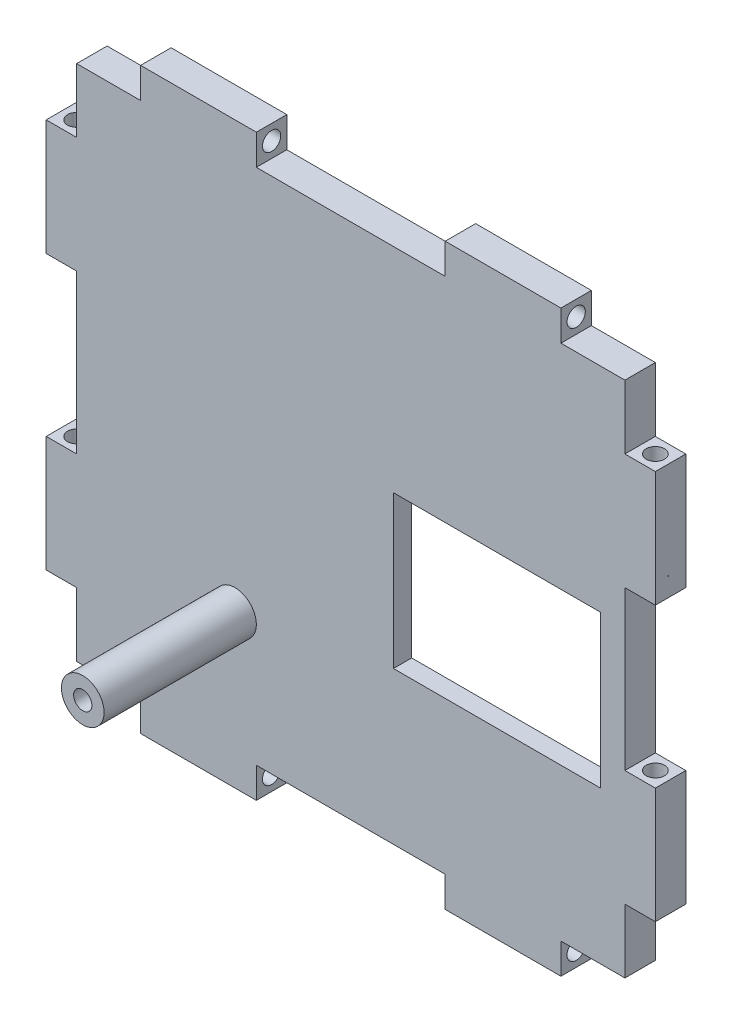
from build123d import *

# Parameters (mm, degrees)
BOSS_EXTRU_1_DEPTH      = 5
ENL_V_MAT_EXTRU_1_REACH = 129.849
ESQUISSE2_R             = 1.5
ENL_V_MAT_EXTRU_2_REACH = 136.797
ESQUISSE3_R             = 1.5
ENL_V_MAT_EXTRU_3_REACH = 129.849
ESQUISSE4_R             = 1.5
ENL_V_MAT_EXTRU_4_REACH = 129.615
ESQUISSE5_R             = 1.5
ESQUISSE6_R             = 3.5
ESQUISSE6_R_2           = 1.5
BOSS_EXTRU_2_DEPTH      = 30
ENL_V_MAT_EXTRU_5_REACH = 142.518
ESQUISSE7_R             = 1.5
ESQUISSE8_W             = 34
ESQUISSE8_H             = 25
ENL_V_MAT_EXTRU_6_DEPTH = 5
ESQUISSE9_W             = 51
ESQUISSE9_H             = 51
ENL_V_MAT_EXTRU_7_DEPTH = 2


with BuildPart() as part:
    # Esquisse1 → Boss.-Extru.1 (new body)
    with BuildSketch(Plane.XY):
        Polygon((15.5, 95.5), (15.5, 90.5), (5, 90.5), (5, 80), (0, 80), (0, 61), (5, 61), (5, 35), (0, 35), (0, 16), (5, 16), (5, 5.5), (15.5, 5.5), (15.5, 0.5), (34.5, 0.5), (34.5, 5.5), (65.5, 5.5), (65.5, 0.5), (84.5, 0.5), (84.5, 5.5), (95, 5.5), (95, 16), (100, 16), (100, 35), (95, 35), (95, 61), (100, 61), (100, 80), (95, 80), (95, 90.5), (84.5, 90.5), (84.5, 95.5), (65.5, 95.5), (65.5, 90.5), (34.5, 90.5), (34.5, 95.5), align=None)
    extrude(amount=BOSS_EXTRU_1_DEPTH)

    # Enlèv. mat.-Extru.1: up to this face of the body (flat: up to its plane)
    enl_v_mat_extru_1_end = Plane(part.part.faces().sort_by_distance((97.5, 80, 2.5))[0])
    # Esquisse2 → Enlèv. mat.-Extru.1 (cut, up to the picked face)
    with BuildSketch(Plane.XZ.offset(-16), mode=Mode.PRIVATE) as enl_v_mat_extru_1_sk1:
        with Locations((97.5, 2.5)):
            Circle(ESQUISSE2_R)
    enl_v_mat_extru_1_tool1 = split(extrude(enl_v_mat_extru_1_sk1.sketch, amount=-ENL_V_MAT_EXTRU_1_REACH, mode=Mode.PRIVATE), bisect_by=enl_v_mat_extru_1_end, keep=Keep.BOTH, mode=Mode.PRIVATE)
    add(enl_v_mat_extru_1_tool1.solids().sort_by(Axis((97.5, 16, 2.5), (0, 1, 0)))[0], mode=Mode.SUBTRACT)

    # Enlèv. mat.-Extru.2: up to this face of the body (flat: up to its plane)
    enl_v_mat_extru_2_end = Plane(part.part.faces().sort_by_distance((5, 85.25, 2.5))[0])
    # Esquisse3 → Enlèv. mat.-Extru.2 (cut, up to the picked face)
    with BuildSketch(Plane(origin=(95, 0, 0), x_dir=(0, 0, -1), z_dir=(1, 0, 0)), mode=Mode.PRIVATE) as enl_v_mat_extru_2_sk1:
        with Locations(Location((-2.5, 93, 0), (0, 0, 90))):
            Circle(ESQUISSE3_R)
    enl_v_mat_extru_2_tool1 = split(extrude(enl_v_mat_extru_2_sk1.sketch, amount=-ENL_V_MAT_EXTRU_2_REACH, mode=Mode.PRIVATE), bisect_by=enl_v_mat_extru_2_end, keep=Keep.BOTH, mode=Mode.PRIVATE)
    add(enl_v_mat_extru_2_tool1.solids().sort_by(Axis((95, 93, 2.5), (-1, 0, 0)))[0], mode=Mode.SUBTRACT)

    # Enlèv. mat.-Extru.3: up to this face of the body (flat: up to its plane)
    enl_v_mat_extru_3_end = Plane(part.part.faces().sort_by_distance((2.5, 16, 2.5))[0])
    # Esquisse4 → Enlèv. mat.-Extru.3 (cut, up to the picked face)
    with BuildSketch(Plane(origin=(0, 80, 0), x_dir=(1, 0, 0), z_dir=(0, 1, 0)), mode=Mode.PRIVATE) as enl_v_mat_extru_3_sk1:
        with Locations(Location((2.5, -2.5, 0), (0, 0, 270))):
            Circle(ESQUISSE4_R)
    enl_v_mat_extru_3_tool1 = split(extrude(enl_v_mat_extru_3_sk1.sketch, amount=-ENL_V_MAT_EXTRU_3_REACH, mode=Mode.PRIVATE), bisect_by=enl_v_mat_extru_3_end, keep=Keep.BOTH, mode=Mode.PRIVATE)
    add(enl_v_mat_extru_3_tool1.solids().sort_by(Axis((2.5, 80, 2.5), (0, -1, 0)))[0], mode=Mode.SUBTRACT)

    # Enlèv. mat.-Extru.4: up to this face of the body (flat: up to its plane)
    enl_v_mat_extru_4_end = Plane(part.part.faces().sort_by_distance((84.5, 3, 2.5))[0])
    # Esquisse5 → Enlèv. mat.-Extru.4 (cut, up to the picked face)
    with BuildSketch(Plane.ZY.offset(-15.5), mode=Mode.PRIVATE) as enl_v_mat_extru_4_sk1:
        with Locations((2.5, 3)):
            Circle(ESQUISSE5_R)
    enl_v_mat_extru_4_tool1 = split(extrude(enl_v_mat_extru_4_sk1.sketch, amount=-ENL_V_MAT_EXTRU_4_REACH, mode=Mode.PRIVATE), bisect_by=enl_v_mat_extru_4_end, keep=Keep.BOTH, mode=Mode.PRIVATE)
    add(enl_v_mat_extru_4_tool1.solids().sort_by(Axis((15.5, 3, 2.5), (1, 0, 0)))[0], mode=Mode.SUBTRACT)

    # Esquisse6 → Boss.-Extru.2 (add)
    with BuildSketch(Plane(origin=(0, 0, 0), x_dir=(-1, 0, 0), z_dir=(0, 0, -1))):
        with Locations((-31, 25.5)):
            Circle(ESQUISSE6_R)
        with Locations((-31, 25.5)):
            Circle(ESQUISSE6_R_2, mode=Mode.SUBTRACT)
    extrude(amount=-BOSS_EXTRU_2_DEPTH)

    # Esquisse7 → Enlèv. mat.-Extru.5 (cut, up to next)
    with BuildSketch(Plane.XY.offset(5), mode=Mode.PRIVATE) as enl_v_mat_extru_5_sk1:
        with Locations(Location((31, 25.5, 0), (0, 0, 180))):
            Circle(ESQUISSE7_R)
    enl_v_mat_extru_5_tool1 = extrude(enl_v_mat_extru_5_sk1.sketch, amount=-ENL_V_MAT_EXTRU_5_REACH, mode=Mode.PRIVATE) & part.part
    add(enl_v_mat_extru_5_tool1.solids().sort_by_distance((31, 25.5, 5))[0], mode=Mode.SUBTRACT)

    # Esquisse8 → Enlèv. mat.-Extru.6 (cut)
    with BuildSketch(Plane(origin=(0, 0, 0), x_dir=(-1, 0, 0), z_dir=(0, 0, -1))):
        with Locations((-74, 43)):
            Rectangle(ESQUISSE8_W, ESQUISSE8_H)
    extrude(amount=-ENL_V_MAT_EXTRU_6_DEPTH, mode=Mode.SUBTRACT)

    # Esquisse9 → Enlèv. mat.-Extru.7 (cut)
    with BuildSketch(Plane(origin=(0, 0, 0), x_dir=(-1, 0, 0), z_dir=(0, 0, -1))):
        with Locations((-65.5, 43)):
            Rectangle(ESQUISSE9_W, ESQUISSE9_H)
    extrude(amount=-ENL_V_MAT_EXTRU_7_DEPTH, mode=Mode.SUBTRACT)


solid = part.part
